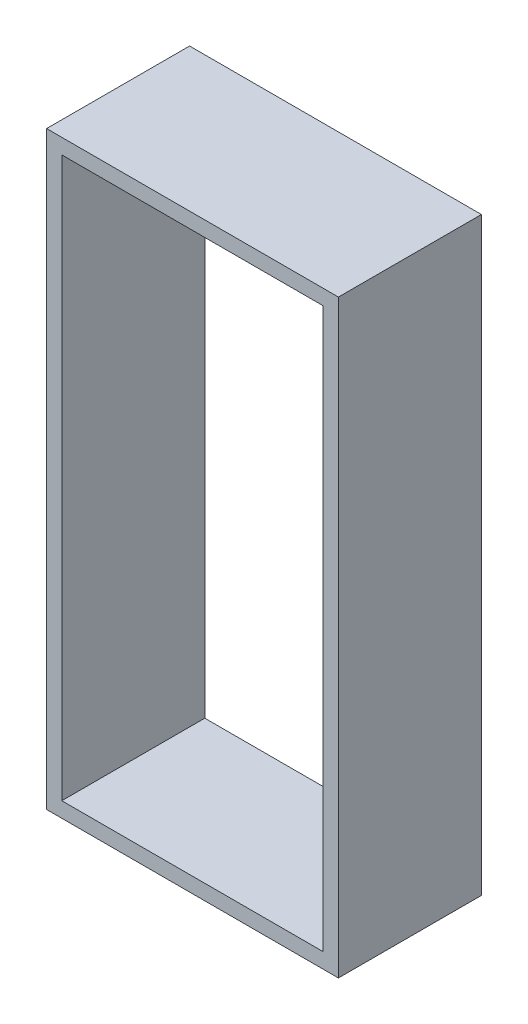
from build123d import *

# Parameters (mm, degrees)
SKETCH1_W           = 60.96
SKETCH1_H           = 123.19
SKETCH1_W_2         = 54.61
SKETCH1_H_2         = 116.84
BOSS_EXTRUDE1_DEPTH = 29.8704


with BuildPart() as part:
    # Sketch1 → Boss-Extrude1 (new body)
    with BuildSketch(Plane.XY):
        with Locations((27.305, 58.42)):
            Rectangle(SKETCH1_W, SKETCH1_H)
        with Locations((27.305, 58.42)):
            Rectangle(SKETCH1_W_2, SKETCH1_H_2, mode=Mode.SUBTRACT)
    extrude(amount=BOSS_EXTRUDE1_DEPTH)


solid = part.part
